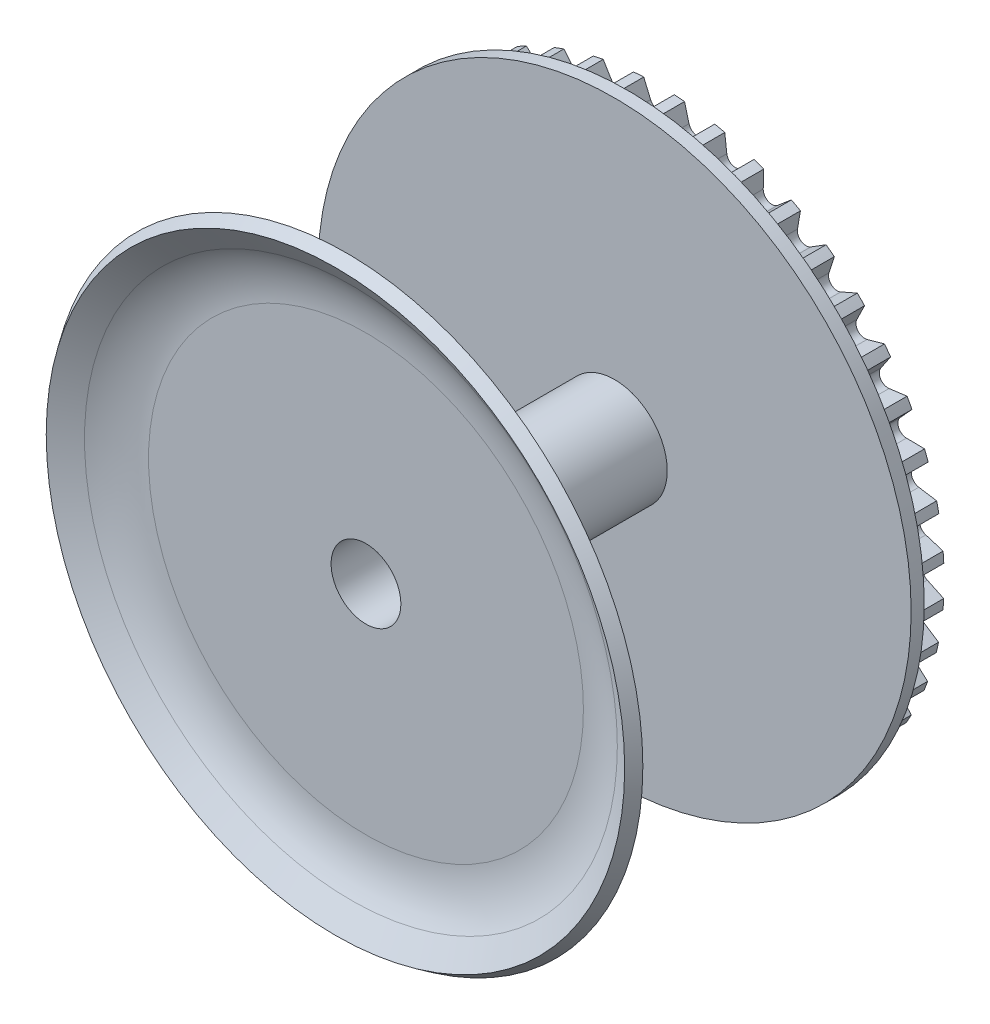
from build123d import *

# Parameters (mm, degrees)
CUT_EXTRUDE1_DEPTH = 6
CIRPATTERN1_COUNT  = 44


with BuildPart() as part:
    # Sketch1 → Revolve1 (revolve)
    with BuildSketch(Plane(origin=(0, 0, 0), x_dir=(0, 0, -1), z_dir=(1, 0, 0)), mode=Mode.PRIVATE) as revolve1_sk:
        with BuildLine():
            Line((-39.734343126, 8), (-39.734343126, 49.85473316))
            ThreePointArc((-39.734343126, 49.85473316), (-40.616459297, 55.728958037), (-43.184994917, 61.085008039))
            Line((-43.184994917, 61.085008039), (-46.734343126, 66.315458768))
            Line((-46.734343126, 66.315458768), (-44.251940895, 68))
            Line((-44.251940895, 68), (-40.184994917, 62.006798065))
            ThreePointArc((-40.184994917, 62.006798065), (-37.616459297, 56.650748063), (-36.734343126, 50.776523186))
            Line((-36.734343126, 50.776523186), (-36.734343126, 12.074806378))
            Line((-36.734343126, 12.074806378), (17.265656874, 12.074806378))
            Line((17.265656874, 12.074806378), (17.265656874, 68))
            Line((17.265656874, 68), (20.265656874, 68))
            Line((20.265656874, 68), (20.265656874, 65.565111861))
            Line((20.265656874, 65.565111861), (20.265656874, 17.973222406))
            Line((20.265656874, 17.973222406), (21.265656874, 17.973222406))
            Line((21.265656874, 17.973222406), (21.265656874, 65.565111861))
            Line((21.265656874, 65.565111861), (27.265656874, 65.565111861))
            Line((27.265656874, 65.565111861), (27.265656874, 8))
            Line((27.265656874, 8), (-39.734343126, 8))
        make_face()
    revolve(revolve1_sk.sketch.rotate(Axis((0, 0, 87.54807802), (0, 0, -1)), 90), axis=Axis((0, 0, 87.54807802), (0, 0, -1)))

    # Sketch2 → Cut-Extrude1 (cut)
    with BuildSketch(Plane(origin=(0, 0, -27.265656874), x_dir=(-1, 0, 0), z_dir=(0, 0, -1))):
        with BuildLine():
            Line((-3.685355592, 65.46145467), (-1.906001686, 61.709702497))
            ThreePointArc((-1.906001686, 61.709702497), (-0.058363123, 60.567155365), (1.741405749, 61.783713716))
            Line((1.741405749, 61.783713716), (3.314644408, 65.481272329))
            Line((3.314644408, 65.481272329), (-0.316960586, 66.240676708))
            Line((-0.316960586, 66.240676708), (-3.685355592, 65.46145467))
        make_face()
    cut_extrude1 = extrude(amount=-CUT_EXTRUDE1_DEPTH, mode=Mode.SUBTRACT)

    # CirPattern1: Cut-Extrude1 ×44 about axis
    cirpattern1_axis = Axis((0, 0, 0), (0, 0, 1))
    for i in range(1, CIRPATTERN1_COUNT):
        add(cut_extrude1.rotate(cirpattern1_axis, i * 360 / CIRPATTERN1_COUNT), mode=Mode.SUBTRACT)


solid = part.part
